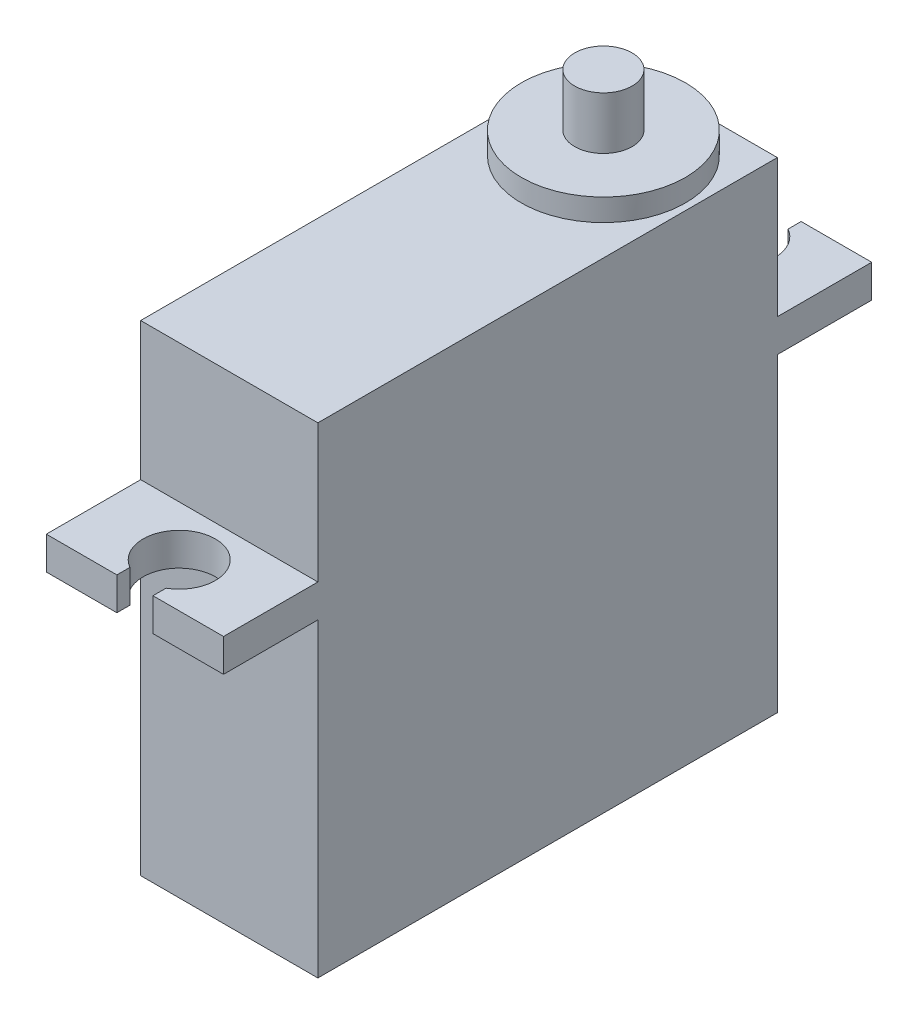
from build123d import *

# Parameters (mm, degrees)
SKETCH1_W           = 10.8
SKETCH1_H           = 28
BOSS_EXTRUDE1_DEPTH = 29.3
BOSS_EXTRUDE2_DEPTH = 2
SKETCH3_R           = 5
BOSS_EXTRUDE3_DEPTH = 1.35
SKETCH4_R           = 1.75
BOSS_EXTRUDE4_DEPTH = 3.2


with BuildPart() as part:
    # Sketch1 → Boss-Extrude1 (new body)
    with BuildSketch(Plane(origin=(0, 0, 0), x_dir=(1, 0, 0), z_dir=(0, 1, 0))):
        with Locations((5.4, 14)):
            Rectangle(SKETCH1_W, SKETCH1_H)
    extrude(amount=BOSS_EXTRUDE1_DEPTH)

    # Sketch2 → Boss-Extrude2 (add)
    with BuildSketch(Plane(origin=(0, 20.9, 0), x_dir=(1, 0, 0), z_dir=(0, 1, 0))):
        with BuildLine():
            Line((0, 28), (10.8, 28))
            Line((10.8, 28), (10.8, 33.75))
            Line((10.8, 33.75), (6.5, 33.75))
            Line((6.5, 33.75), (6.5, 32.955255888))
            ThreePointArc((6.5, 32.955255888), (5.4, 28.85), (4.3, 32.955255888))
            Line((4.3, 32.955255888), (4.3, 33.75))
            Line((4.3, 33.75), (0, 33.75))
            Line((0, 33.75), (0, 28))
        make_face()
        with BuildLine():
            Line((10.8, 0), (10.8, -5.75))
            Line((10.8, -5.75), (6.5, -5.75))
            Line((6.5, -5.75), (6.5, -4.955255888))
            ThreePointArc((6.5, -4.955255888), (5.4, -0.85), (4.3, -4.955255888))
            Line((4.3, -4.955255888), (4.3, -5.75))
            Line((4.3, -5.75), (0, -5.75))
            Line((0, -5.75), (0, 0))
            Line((0, 0), (10.8, 0))
        make_face()
    extrude(amount=-BOSS_EXTRUDE2_DEPTH)

    # Sketch3 → Boss-Extrude3 (add)
    with BuildSketch(Plane(origin=(0, 29.3, 0), x_dir=(1, 0, 0), z_dir=(0, 1, 0))):
        with Locations(Location((5.4, 22.8, 0), (0, 0, 90))):
            Circle(SKETCH3_R)
    extrude(amount=BOSS_EXTRUDE3_DEPTH)

    # Sketch4 → Boss-Extrude4 (add)
    with BuildSketch(Plane(origin=(0, 30.65, 0), x_dir=(1, 0, 0), z_dir=(0, 1, 0))):
        with Locations(Location((5.4, 22.8, 0), (0, 0, 270))):
            Circle(SKETCH4_R)
    extrude(amount=BOSS_EXTRUDE4_DEPTH)


solid = part.part
